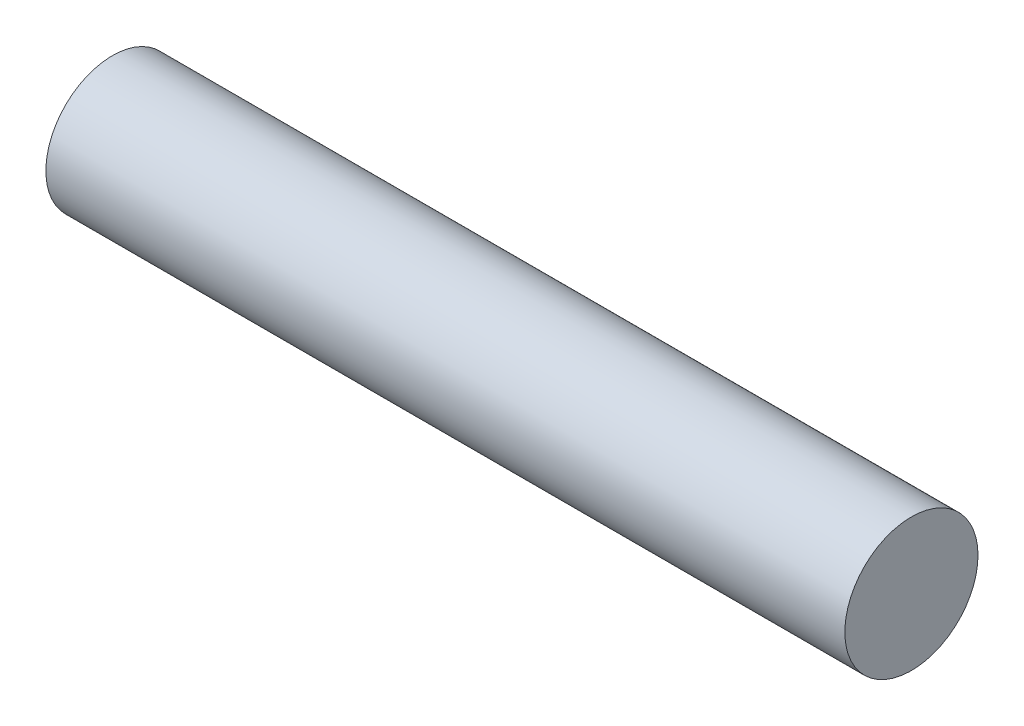
from build123d import *

# Parameters (mm, degrees)
SKETCH2_R           = 18.75
BOSS_EXTRUDE1_DEPTH = 225


with BuildPart() as part:
    # Sketch2 → Boss-Extrude1 (new body)
    with BuildSketch(Plane(origin=(0, 0, 0), x_dir=(0, 0, -1), z_dir=(1, 0, 0))):
        with Locations((-4536.877528984, 2613.660227605)):
            Circle(SKETCH2_R)
    extrude(amount=BOSS_EXTRUDE1_DEPTH)


solid = part.part
